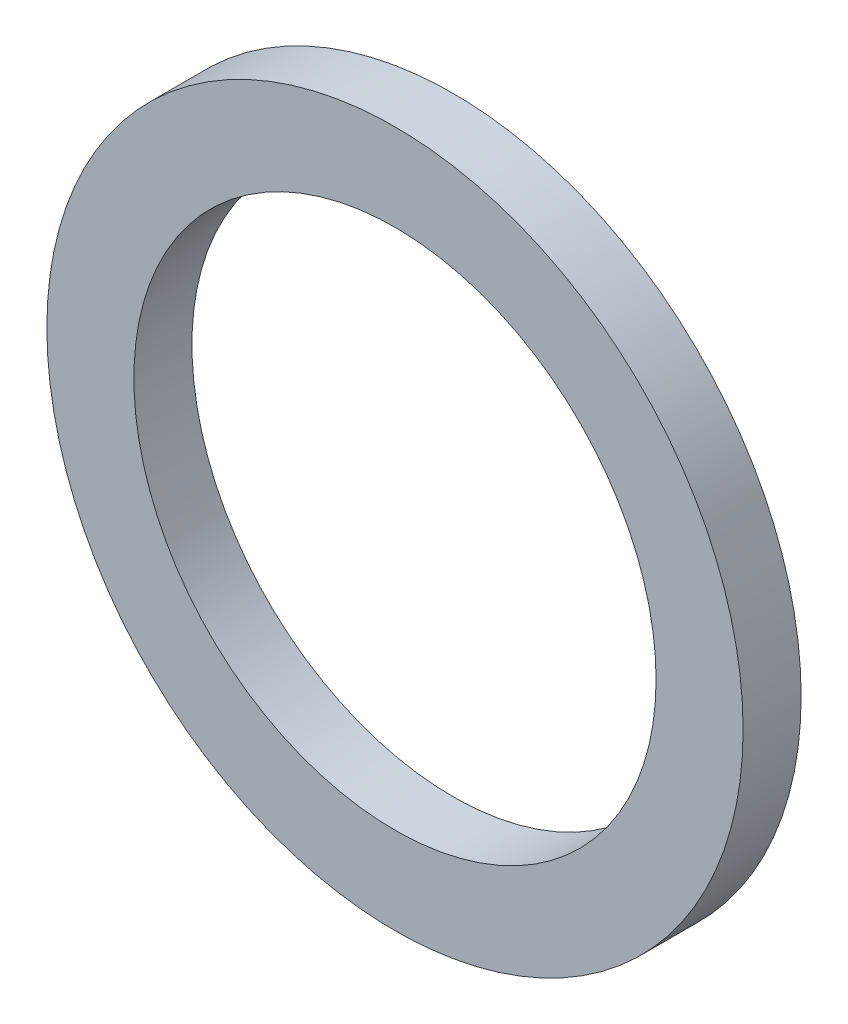
from build123d import *

# Parameters (mm, degrees)
SKETCH1_R           = 36
BOSS_EXTRUDE1_DEPTH = 6
SKETCH2_R           = 27
CUT_EXTRUDE1_DEPTH  = 52.264022472


with BuildPart() as part:
    # Sketch1 → Boss-Extrude1 (new body)
    with BuildSketch(Plane.XY):
        Circle(SKETCH1_R)
    extrude(amount=BOSS_EXTRUDE1_DEPTH)

    # Sketch2 → Cut-Extrude1 (cut, through all)
    with BuildSketch(Plane.XY.offset(6)):
        Circle(SKETCH2_R)
    extrude(amount=-CUT_EXTRUDE1_DEPTH, mode=Mode.SUBTRACT)


solid = part.part
